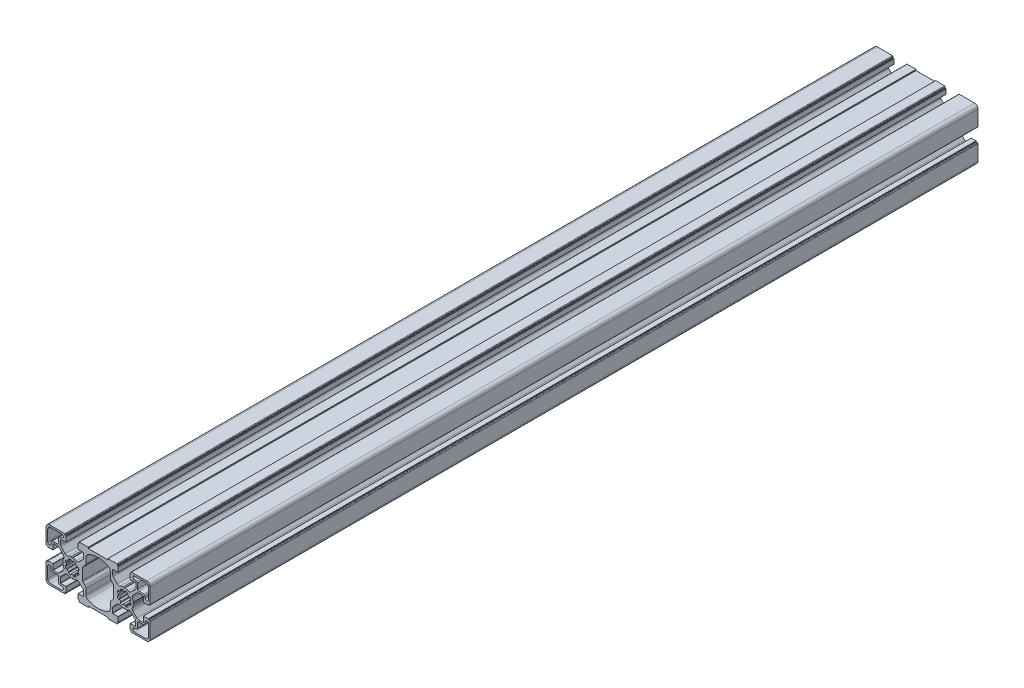
from build123d import *

# Parameters (mm, degrees)
EXTRUDE_1_DEPTH = 715


with BuildPart() as part:
    # Model → Бобышка-Вытянуть1 (new body)
    with BuildSketch(Plane.XY):
        with BuildLine():
            Line((-8.5, 22.500008063), (-8.5, 21.500029888))
            Line((-8.5, 21.500029888), (8.5, 21.500029888))
            Line((8.5, 21.500029888), (8.5, 22.500029888))
            Line((8.5, 22.500029888), (16.124257037, 22.500029888))
            ThreePointArc((16.124257037, 22.500029888), (16.477810482, 22.353583256), (16.624257115, 22.000029811))
            Line((16.624257115, 22.000029811), (16.624257115, 21.300028976))
            ThreePointArc((16.624257115, 21.300028976), (16.712124882, 21.087897421), (16.924256437, 21.000029654))
            Line((16.924256437, 21.000029654), (17.050001302, 21.000029654))
            ThreePointArc((17.050001302, 21.000029654), (17.262133369, 20.912161674), (17.350001348, 20.700029607))
            Line((17.350001348, 20.700029607), (17.350001348, 16.700063723))
            ThreePointArc((17.350001348, 16.700063723), (17.291422695, 16.558642345), (17.150001317, 16.500063692))
            Line((17.150001317, 16.500063692), (12.705479089, 16.500063692))
            ThreePointArc((12.705479089, 16.500063692), (12.56405771, 16.441485039), (12.505479058, 16.300063661))
            Line((12.505479058, 16.300063661), (12.505479058, 12.50480571))
            ThreePointArc((12.505479058, 12.50480571), (12.65349601, 11.760673694), (13.07501266, 11.129828872))
            Line((13.07501266, 11.129828872), (16.654447635, 7.550389883))
            ThreePointArc((16.654447635, 7.550389883), (17.743800748, 6.991162659), (18.954930197, 7.171691748))
            ThreePointArc((18.954930197, 7.171691748), (20.293417106, 7.6897158), (21.702924867, 7.960241203))
            Line((21.702924867, 7.960241203), (22.500002149, 7.50004842))
            Line((22.500002149, 7.50004842), (23.29707943, 7.960241203))
            ThreePointArc((23.29707943, 7.960241203), (24.754381486, 7.675839962), (26.134026772, 7.127030131))
            ThreePointArc((26.134026772, 7.127030131), (27.355110889, 6.933352792), (28.456746709, 7.494562068))
            Line((28.456746709, 7.494562068), (32.019602582, 11.05741794))
            ThreePointArc((32.019602582, 11.05741794), (32.453148282, 11.706264934), (32.605389286, 12.471632147))
            Line((32.605389286, 12.471632147), (32.605389286, 16.300063661))
            ThreePointArc((32.605389286, 16.300063661), (32.546810633, 16.441485039), (32.405389255, 16.500063692))
            Line((32.405389255, 16.500063692), (27.850002979, 16.500063692))
            ThreePointArc((27.850002979, 16.500063692), (27.708581601, 16.558642345), (27.650002948, 16.700063723))
            Line((27.650002948, 16.700063723), (27.650002948, 20.700065567))
            ThreePointArc((27.650002948, 20.700065567), (27.737870569, 20.912196769), (27.950001771, 21.00006439))
            Line((27.950001771, 21.00006439), (28.075713124, 21.00006439))
            ThreePointArc((28.075713124, 21.00006439), (28.287844679, 21.087932157), (28.375712447, 21.300063712))
            Line((28.375712447, 21.300063712), (28.375712447, 22.000064919))
            ThreePointArc((28.375712447, 22.000064919), (28.522158969, 22.3536181), (28.875712151, 22.500064623))
            Line((28.875712151, 22.500064623), (41.999986557, 22.500064623))
            ThreePointArc((41.999986557, 22.500064623), (44.121305645, 21.621385487), (44.999984781, 19.500066399))
            Line((44.999984781, 19.500066399), (44.999984781, 6.375792367))
            ThreePointArc((44.999984781, 6.375792367), (44.853538149, 6.022238922), (44.499984704, 5.87579229))
            Line((44.499984704, 5.87579229), (43.799983869, 5.87579229))
            ThreePointArc((43.799983869, 5.87579229), (43.587852314, 5.787924523), (43.499984547, 5.575792967))
            Line((43.499984547, 5.575792967), (43.499984547, 5.450048103))
            ThreePointArc((43.499984547, 5.450048103), (43.412116567, 5.237916036), (43.1999845, 5.150048056))
            Line((43.1999845, 5.150048056), (39.200018616, 5.150048056))
            ThreePointArc((39.200018616, 5.150048056), (39.058597238, 5.208626709), (39.000018585, 5.350048087))
            Line((39.000018585, 5.350048087), (39.000018585, 9.794570316))
            ThreePointArc((39.000018585, 9.794570316), (38.941439932, 9.935991694), (38.800018554, 9.994570347))
            Line((38.800018554, 9.994570347), (35.004760603, 9.994570347))
            ThreePointArc((35.004760603, 9.994570347), (34.260628587, 9.846553394), (33.629783765, 9.425036744))
            Line((33.629783765, 9.425036744), (30.050344776, 5.84560177))
            ThreePointArc((30.050344776, 5.84560177), (29.491117552, 4.756248656), (29.671646641, 3.545119207))
            ThreePointArc((29.671646641, 3.545119207), (30.189670693, 2.206632298), (30.460196096, 0.797124537))
            Line((30.460196096, 0.797124537), (30.000003313, 4.7256e-05))
            Line((30.000003313, 4.7256e-05), (30.460196096, -0.797030026))
            ThreePointArc((30.460196096, -0.797030026), (30.175794855, -2.254332081), (29.626985024, -3.633977367))
            ThreePointArc((29.626985024, -3.633977367), (29.433307685, -4.855061485), (29.994516961, -5.956697305))
            Line((29.994516961, -5.956697305), (33.557372833, -9.519553177))
            ThreePointArc((33.557372833, -9.519553177), (34.206219827, -9.953098877), (34.97158704, -10.105339882))
            Line((34.97158704, -10.105339882), (38.800018554, -10.105339882))
            ThreePointArc((38.800018554, -10.105339882), (38.941439932, -10.046761229), (39.000018585, -9.905339851))
            Line((39.000018585, -9.905339851), (39.000018585, -5.349953575))
            ThreePointArc((39.000018585, -5.349953575), (39.058597238, -5.208532197), (39.200018616, -5.149953544))
            Line((39.200018616, -5.149953544), (43.20002046, -5.149953544))
            ThreePointArc((43.20002046, -5.149953544), (43.412151662, -5.237821164), (43.500019283, -5.449952366))
            Line((43.500019283, -5.449952366), (43.500019283, -5.57566372))
            ThreePointArc((43.500019283, -5.57566372), (43.58788705, -5.787795275), (43.800018605, -5.875663042))
            Line((43.800018605, -5.875663042), (44.500035031, -5.875663042))
            ThreePointArc((44.500035031, -5.875663042), (44.853595863, -6.022117215), (45.000034735, -6.375684384))
            Line((45.000034735, -6.375684384), (45.000034735, -19.499937152))
            ThreePointArc((45.000034735, -19.499937152), (44.121350218, -21.621261621), (42.000021292, -22.499935377))
            Line((42.000021292, -22.499935377), (28.87574726, -22.499935377))
            ThreePointArc((28.87574726, -22.499935377), (28.522193815, -22.353488745), (28.375747183, -21.999935299))
            Line((28.375747183, -21.999935299), (28.375747183, -21.299934465))
            ThreePointArc((28.375747183, -21.299934465), (28.287879416, -21.087802909), (28.07574786, -20.999935142))
            Line((28.07574786, -20.999935142), (27.950002996, -20.999935142))
            ThreePointArc((27.950002996, -20.999935142), (27.737870929, -20.912067163), (27.650002949, -20.699935096))
            Line((27.650002949, -20.699935096), (27.650002949, -16.699969212))
            ThreePointArc((27.650002949, -16.699969212), (27.708581602, -16.558547833), (27.85000298, -16.49996918))
            Line((27.85000298, -16.49996918), (32.294525209, -16.49996918))
            ThreePointArc((32.294525209, -16.49996918), (32.435946587, -16.441390528), (32.49452524, -16.299969149))
            Line((32.49452524, -16.299969149), (32.49452524, -12.504711198))
            ThreePointArc((32.49452524, -12.504711198), (32.346508287, -11.760579183), (31.924991638, -11.129734361))
            Line((31.924991638, -11.129734361), (28.345556663, -7.550295371))
            ThreePointArc((28.345556663, -7.550295371), (27.256203549, -6.991068147), (26.0450741, -7.171597237))
            ThreePointArc((26.0450741, -7.171597237), (24.706587191, -7.689621288), (23.29707943, -7.960146691))
            Line((23.29707943, -7.960146691), (22.500002149, -7.499953908))
            Line((22.500002149, -7.499953908), (21.702924867, -7.960146691))
            ThreePointArc((21.702924867, -7.960146691), (20.245622812, -7.675745451), (18.865977526, -7.12693562))
            ThreePointArc((18.865977526, -7.12693562), (17.644893409, -6.93325828), (16.543257588, -7.494467557))
            Line((16.543257588, -7.494467557), (12.980401716, -11.057323429))
            ThreePointArc((12.980401716, -11.057323429), (12.546856016, -11.706170422), (12.394615011, -12.471537636))
            Line((12.394615011, -12.471537636), (12.394615011, -16.299969149))
            ThreePointArc((12.394615011, -16.299969149), (12.453193664, -16.441390528), (12.594615042, -16.49996918))
            Line((12.594615042, -16.49996918), (17.150001318, -16.49996918))
            ThreePointArc((17.150001318, -16.49996918), (17.291422696, -16.558547833), (17.350001349, -16.699969212))
            Line((17.350001349, -16.699969212), (17.350001349, -20.699971056))
            ThreePointArc((17.350001349, -20.699971056), (17.262133729, -20.912102258), (17.050002527, -20.999969878))
            Line((17.050002527, -20.999969878), (16.924291173, -20.999969878))
            ThreePointArc((16.924291173, -20.999969878), (16.712159618, -21.087837646), (16.624291851, -21.299969201))
            Line((16.624291851, -21.299969201), (16.624291851, -21.999970408))
            ThreePointArc((16.624291851, -21.999970408), (16.477845328, -22.353523589), (16.124292147, -22.499970112))
            Line((16.124292147, -22.499970112), (8.5, -22.499970112))
            Line((8.5, -22.499970112), (8.5, -21.499970112))
            Line((8.5, -21.499970112), (-5.500036511, -21.499970112))
            Line((-5.500036511, -21.499970112), (-8.5, -21.499970112))
            Line((-8.5, -21.499970112), (-8.5, -22.499991936))
            Line((-8.5, -22.499991936), (-16.124237521, -22.499991936))
            ThreePointArc((-16.124237521, -22.499991936), (-16.477790966, -22.353545304), (-16.624237598, -21.999991859))
            Line((-16.624237598, -21.999991859), (-16.624237598, -21.299991024))
            ThreePointArc((-16.624237598, -21.299991024), (-16.712105366, -21.087859469), (-16.924236921, -20.999991702))
            Line((-16.924236921, -20.999991702), (-17.049981785, -20.999991702))
            ThreePointArc((-17.049981785, -20.999991702), (-17.262113853, -20.912123722), (-17.349981832, -20.699991655))
            Line((-17.349981832, -20.699991655), (-17.349981832, -16.700025771))
            ThreePointArc((-17.349981832, -16.700025771), (-17.291403179, -16.558604393), (-17.149981801, -16.50002574))
            Line((-17.149981801, -16.50002574), (-12.705459572, -16.50002574))
            ThreePointArc((-12.705459572, -16.50002574), (-12.564038194, -16.441447087), (-12.505459541, -16.300025709))
            Line((-12.505459541, -16.300025709), (-12.505459541, -12.504767758))
            ThreePointArc((-12.505459541, -12.504767758), (-12.653476494, -11.760635742), (-13.074993144, -11.129790921))
            Line((-13.074993144, -11.129790921), (-16.654428119, -7.550351931))
            ThreePointArc((-16.654428119, -7.550351931), (-17.743781232, -6.991124707), (-18.954910681, -7.171653796))
            ThreePointArc((-18.954910681, -7.171653796), (-20.29339759, -7.689677848), (-21.702905351, -7.960203251))
            Line((-21.702905351, -7.960203251), (-22.499982633, -7.500010468))
            Line((-22.499982633, -7.500010468), (-23.297059914, -7.960203251))
            ThreePointArc((-23.297059914, -7.960203251), (-24.754361969, -7.67580201), (-26.134007256, -7.126992179))
            ThreePointArc((-26.134007256, -7.126992179), (-27.355091373, -6.93331484), (-28.456727193, -7.494524116))
            Line((-28.456727193, -7.494524116), (-32.019583065, -11.057379988))
            ThreePointArc((-32.019583065, -11.057379988), (-32.453128766, -11.706226982), (-32.60536977, -12.471594195))
            Line((-32.60536977, -12.471594195), (-32.60536977, -16.300025709))
            ThreePointArc((-32.60536977, -16.300025709), (-32.546791117, -16.441447087), (-32.405369739, -16.50002574))
            Line((-32.405369739, -16.50002574), (-27.849983463, -16.50002574))
            ThreePointArc((-27.849983463, -16.50002574), (-27.708562085, -16.558604393), (-27.649983432, -16.700025771))
            Line((-27.649983432, -16.700025771), (-27.649983432, -20.700027615))
            ThreePointArc((-27.649983432, -20.700027615), (-27.737851053, -20.912158817), (-27.949982254, -21.000026438))
            Line((-27.949982254, -21.000026438), (-28.075693608, -21.000026438))
            ThreePointArc((-28.075693608, -21.000026438), (-28.287825163, -21.087894205), (-28.37569293, -21.30002576))
            Line((-28.37569293, -21.30002576), (-28.37569293, -22.000026967))
            ThreePointArc((-28.37569293, -22.000026967), (-28.522139453, -22.353580148), (-28.875692635, -22.500026671))
            Line((-28.875692635, -22.500026671), (-41.999967041, -22.500026671))
            ThreePointArc((-41.999967041, -22.500026671), (-44.121286129, -21.621347535), (-44.999965265, -19.500028447))
            Line((-44.999965265, -19.500028447), (-44.999965265, -6.375754415))
            ThreePointArc((-44.999965265, -6.375754415), (-44.853518633, -6.02220097), (-44.499965187, -5.875754338))
            Line((-44.499965187, -5.875754338), (-43.799964353, -5.875754338))
            ThreePointArc((-43.799964353, -5.875754338), (-43.587832798, -5.787886571), (-43.49996503, -5.575755015))
            Line((-43.49996503, -5.575755015), (-43.49996503, -5.450010151))
            ThreePointArc((-43.49996503, -5.450010151), (-43.412097051, -5.237878083), (-43.199964984, -5.150010104))
            Line((-43.199964984, -5.150010104), (-39.1999991, -5.150010104))
            ThreePointArc((-39.1999991, -5.150010104), (-39.058577722, -5.208588757), (-38.999999069, -5.350010135))
            Line((-38.999999069, -5.350010135), (-38.999999069, -9.794532364))
            ThreePointArc((-38.999999069, -9.794532364), (-38.941420416, -9.935953742), (-38.799999038, -9.994532395))
            Line((-38.799999038, -9.994532395), (-35.004741087, -9.994532395))
            ThreePointArc((-35.004741087, -9.994532395), (-34.260609071, -9.846515442), (-33.629764249, -9.424998792))
            Line((-33.629764249, -9.424998792), (-30.050325259, -5.845563818))
            ThreePointArc((-30.050325259, -5.845563818), (-29.491098036, -4.756210704), (-29.671627125, -3.545081255))
            ThreePointArc((-29.671627125, -3.545081255), (-30.189651176, -2.206594346), (-30.460176579, -0.797086585))
            Line((-30.460176579, -0.797086585), (-29.999983796, -9.304e-06))
            Line((-29.999983796, -9.304e-06), (-30.460176579, 0.797067977))
            ThreePointArc((-30.460176579, 0.797067977), (-30.175775339, 2.254370033), (-29.626965508, 3.634015319))
            ThreePointArc((-29.626965508, 3.634015319), (-29.433288168, 4.855099436), (-29.994497445, 5.956735257))
            Line((-29.994497445, 5.956735257), (-33.557353317, 9.519591129))
            ThreePointArc((-33.557353317, 9.519591129), (-34.20620031, 9.953136829), (-34.971567524, 10.105377833))
            Line((-34.971567524, 10.105377833), (-38.799999037, 10.105377833))
            ThreePointArc((-38.799999037, 10.105377833), (-38.941420416, 10.046799181), (-38.999999068, 9.905377802))
            Line((-38.999999068, 9.905377802), (-38.999999068, 5.349991526))
            ThreePointArc((-38.999999068, 5.349991526), (-39.058577721, 5.208570148), (-39.199999099, 5.149991495))
            Line((-39.199999099, 5.149991495), (-43.200000944, 5.149991495))
            ThreePointArc((-43.200000944, 5.149991495), (-43.412132146, 5.237859116), (-43.499999766, 5.449990318))
            Line((-43.499999766, 5.449990318), (-43.499999766, 5.575701671))
            ThreePointArc((-43.499999766, 5.575701671), (-43.587867533, 5.787833227), (-43.799999089, 5.875700994))
            Line((-43.799999089, 5.875700994), (-44.500000296, 5.875700994))
            ThreePointArc((-44.500000296, 5.875700994), (-44.853553477, 6.022147517), (-45, 6.375700698))
            Line((-45, 6.375700698), (-45, 19.499975104))
            ThreePointArc((-45, 19.499975104), (-44.121320863, 21.621294192), (-42.000001775, 22.499973328))
            Line((-42.000001775, 22.499973328), (-28.875727744, 22.499973328))
            ThreePointArc((-28.875727744, 22.499973328), (-28.522174298, 22.353526696), (-28.375727666, 21.999973251))
            Line((-28.375727666, 21.999973251), (-28.375727666, 21.299972416))
            ThreePointArc((-28.375727666, 21.299972416), (-28.287859899, 21.087840861), (-28.075728344, 20.999973094))
            Line((-28.075728344, 20.999973094), (-27.949983479, 20.999973094))
            ThreePointArc((-27.949983479, 20.999973094), (-27.737851412, 20.912105114), (-27.649983433, 20.699973047))
            Line((-27.649983433, 20.699973047), (-27.649983433, 16.700007163))
            ThreePointArc((-27.649983433, 16.700007163), (-27.708562086, 16.558585785), (-27.849983464, 16.500007132))
            Line((-27.849983464, 16.500007132), (-32.294505692, 16.500007132))
            ThreePointArc((-32.294505692, 16.500007132), (-32.435927071, 16.441428479), (-32.494505723, 16.300007101))
            Line((-32.494505723, 16.300007101), (-32.494505723, 12.50474915))
            ThreePointArc((-32.494505723, 12.50474915), (-32.346488771, 11.760617134), (-31.924972121, 11.129772312))
            Line((-31.924972121, 11.129772312), (-28.345537146, 7.550333323))
            ThreePointArc((-28.345537146, 7.550333323), (-27.256184033, 6.991106099), (-26.045054584, 7.171635188))
            ThreePointArc((-26.045054584, 7.171635188), (-24.706567675, 7.68965924), (-23.297059914, 7.960184643))
            Line((-23.297059914, 7.960184643), (-22.499982632, 7.49999186))
            Line((-22.499982632, 7.49999186), (-21.702905351, 7.960184643))
            ThreePointArc((-21.702905351, 7.960184643), (-20.245603296, 7.675783402), (-18.865958009, 7.126973571))
            ThreePointArc((-18.865958009, 7.126973571), (-17.644873892, 6.933296232), (-16.543238072, 7.494505508))
            Line((-16.543238072, 7.494505508), (-12.9803822, 11.05736138))
            ThreePointArc((-12.9803822, 11.05736138), (-12.546836499, 11.706208374), (-12.394595495, 12.471575587))
            Line((-12.394595495, 12.471575587), (-12.394595495, 16.300007101))
            ThreePointArc((-12.394595495, 16.300007101), (-12.453174148, 16.441428479), (-12.594595526, 16.500007132))
            Line((-12.594595526, 16.500007132), (-17.149981802, 16.500007132))
            ThreePointArc((-17.149981802, 16.500007132), (-17.29140318, 16.558585785), (-17.349981833, 16.700007163))
            Line((-17.349981833, 16.700007163), (-17.349981833, 20.700009007))
            ThreePointArc((-17.349981833, 20.700009007), (-17.262114212, 20.912140209), (-17.049983011, 21.00000783))
            Line((-17.049983011, 21.00000783), (-16.924271657, 21.00000783))
            ThreePointArc((-16.924271657, 21.00000783), (-16.712140102, 21.087875597), (-16.624272334, 21.300007152))
            Line((-16.624272334, 21.300007152), (-16.624272334, 22.000008359))
            ThreePointArc((-16.624272334, 22.000008359), (-16.477825812, 22.35356154), (-16.12427263, 22.500008063))
            Line((-16.12427263, 22.500008063), (-8.5, 22.500008063))
        make_face()
        with BuildLine():
            Line((-43.499999767, 8.999971231), (-43.499999767, 18.499974573))
            ThreePointArc((-43.499999767, 18.499974573), (-42.767767153, 20.26774048), (-41.000001246, 20.999973094))
            Line((-41.000001246, 20.999973094), (-31.500188904, 20.999973094))
            Line((-31.500188904, 20.999973094), (-31.490188671, 20.999973094))
            ThreePointArc((-31.490188671, 20.999973094), (-30.436599567, 20.563562198), (-30.000188671, 19.509973094))
            Line((-30.000188671, 19.509973094), (-30.000188671, 19.489972628))
            ThreePointArc((-30.000188671, 19.489972628), (-30.436599567, 18.436383524), (-31.490188671, 17.999972628))
            Line((-31.490188671, 17.999972628), (-31.500188671, 17.999972628))
            Line((-31.500188671, 17.999972628), (-32.994505801, 17.999972628))
            ThreePointArc((-32.994505801, 17.999972628), (-33.701612692, 17.707079364), (-33.994505957, 16.999972473))
            Line((-33.994505957, 16.999972473), (-33.994505957, 12.605378221))
            ThreePointArc((-33.994505957, 12.605378221), (-34.287399221, 11.89827133), (-34.994506112, 11.605378066))
            Line((-34.994506112, 11.605378066), (-39.499999146, 11.605378066))
            ThreePointArc((-39.499999146, 11.605378066), (-40.207106037, 11.312484802), (-40.499999301, 10.605377911))
            Line((-40.499999301, 10.605377911), (-40.499999301, 8.999970998))
            ThreePointArc((-40.499999301, 8.999970998), (-40.939339211, 7.939310744), (-41.999999534, 7.499970998))
            ThreePointArc((-41.999999534, 7.499970998), (-43.06065987, 7.939310895), (-43.499999767, 8.999971231))
        make_face(mode=Mode.SUBTRACT)
        with BuildLine():
            Line((-19.308670231, 4.56258962), (-19.635981767, 4.098466852))
            ThreePointArc((-19.635981767, 4.098466852), (-18.969849134, 3.540917869), (-18.410269108, 2.876490487))
            Line((-18.410269108, 2.876490487), (-17.933204273, 3.208153697))
            ThreePointArc((-17.933204273, 3.208153697), (-17.531021017, 3.29876189), (-17.197483921, 3.056451713))
            ThreePointArc((-17.197483921, 3.056451713), (-16.849314042, 2.354717818), (-16.593945552, 1.6141507))
            ThreePointArc((-16.593945552, 1.6141507), (-16.659386206, 1.205563782), (-17.010251083, 0.986202009))
            Line((-17.010251083, 0.986202009), (-17.579436103, 0.887813659))
            ThreePointArc((-17.579436103, 0.887813659), (-17.499981856, -9.304e-06), (-17.579436103, -0.887832267))
            Line((-17.579436103, -0.887832267), (-17.010251083, -0.986220617))
            ThreePointArc((-17.010251083, -0.986220617), (-16.659386206, -1.20558239), (-16.593945552, -1.614169308))
            ThreePointArc((-16.593945552, -1.614169308), (-16.849314042, -2.354736426), (-17.197483921, -3.056470321))
            ThreePointArc((-17.197483921, -3.056470321), (-17.531021017, -3.298780498), (-17.933204273, -3.208172305))
            Line((-17.933204273, -3.208172305), (-18.410269108, -2.876509095))
            ThreePointArc((-18.410269108, -2.876509095), (-18.969849134, -3.540936477), (-19.635981767, -4.09848546))
            Line((-19.635981767, -4.09848546), (-19.308670231, -4.562608228))
            ThreePointArc((-19.308670231, -4.562608228), (-19.215682631, -4.965821479), (-19.45832639, -5.30101042))
            ThreePointArc((-19.45832639, -5.30101042), (-20.162539348, -5.644083818), (-20.904910968, -5.894083067))
            ThreePointArc((-20.904910968, -5.894083067), (-21.312126729, -5.829599372), (-21.532460802, -5.48112309))
            Line((-21.532460802, -5.48112309), (-21.632593761, -4.924199015))
            ThreePointArc((-21.632593761, -4.924199015), (-22.499982632, -5.00001008), (-23.367371504, -4.924199015))
            Line((-23.367371504, -4.924199015), (-23.467504463, -5.48112309))
            ThreePointArc((-23.467504463, -5.48112309), (-23.687838536, -5.829599372), (-24.095054297, -5.894083067))
            ThreePointArc((-24.095054297, -5.894083067), (-24.838878968, -5.643487876), (-25.544368075, -5.299455592))
            ThreePointArc((-25.544368075, -5.299455592), (-25.784598509, -4.964285149), (-25.691295034, -4.562608228))
            Line((-25.691295034, -4.562608228), (-25.363983498, -4.09848546))
            ThreePointArc((-25.363983498, -4.09848546), (-26.030116131, -3.540936477), (-26.589696157, -2.876509095))
            Line((-26.589696157, -2.876509095), (-27.066760992, -3.208172305))
            ThreePointArc((-27.066760992, -3.208172305), (-27.468944248, -3.298780498), (-27.802481344, -3.056470321))
            ThreePointArc((-27.802481344, -3.056470321), (-28.151243494, -2.35332055), (-28.406831214, -1.611208998))
            ThreePointArc((-28.406831214, -1.611208998), (-28.339735602, -1.204302514), (-27.989714182, -0.986220617))
            Line((-27.989714182, -0.986220617), (-27.420529162, -0.887832267))
            ThreePointArc((-27.420529162, -0.887832267), (-27.499983409, -9.304e-06), (-27.420529162, 0.887813659))
            Line((-27.420529162, 0.887813659), (-27.989714182, 0.986202009))
            ThreePointArc((-27.989714182, 0.986202009), (-28.339735602, 1.204283906), (-28.406831214, 1.61119039))
            ThreePointArc((-28.406831214, 1.61119039), (-28.151243494, 2.353301942), (-27.802481344, 3.056451713))
            ThreePointArc((-27.802481344, 3.056451713), (-27.468944248, 3.29876189), (-27.066760992, 3.208153697))
            Line((-27.066760992, 3.208153697), (-26.589696157, 2.876490487))
            ThreePointArc((-26.589696157, 2.876490487), (-26.030116131, 3.540917869), (-25.363983498, 4.098466852))
            Line((-25.363983498, 4.098466852), (-25.691295034, 4.56258962))
            ThreePointArc((-25.691295034, 4.56258962), (-25.784598509, 4.964266541), (-25.544368075, 5.299436984))
            ThreePointArc((-25.544368075, 5.299436984), (-24.838878968, 5.643469268), (-24.095054297, 5.894064459))
            ThreePointArc((-24.095054297, 5.894064459), (-23.687838536, 5.829580764), (-23.467504463, 5.481104482))
            Line((-23.467504463, 5.481104482), (-23.367371504, 4.924180407))
            ThreePointArc((-23.367371504, 4.924180407), (-22.499982632, 4.999991472), (-21.632593761, 4.924180407))
            Line((-21.632593761, 4.924180407), (-21.532460802, 5.481104482))
            ThreePointArc((-21.532460802, 5.481104482), (-21.312126729, 5.829580764), (-20.904910968, 5.894064459))
            ThreePointArc((-20.904910968, 5.894064459), (-20.162539348, 5.64406521), (-19.45832639, 5.300991812))
            ThreePointArc((-19.45832639, 5.300991812), (-19.215682631, 4.965802871), (-19.308670231, 4.56258962))
        make_face(mode=Mode.SUBTRACT)
        with BuildLine():
            Line((10.5, 14.21), (10.5, 9.452657001))
            ThreePointArc((10.5, 9.452657001), (10.728361402, 8.304606704), (11.378679656, 7.331336658))
            Line((11.378679656, 7.331336658), (13.035533906, 5.674482408))
            ThreePointArc((13.035533906, 5.674482408), (13.252306657, 5.350059059), (13.328427125, 4.967375627))
            Line((13.328427125, 4.967375627), (13.328427125, -4.967342999))
            ThreePointArc((13.328427125, -4.967342999), (13.252306657, -5.350026431), (13.035533906, -5.67444978))
            Line((13.035533906, -5.67444978), (11.378679656, -7.331304029))
            ThreePointArc((11.378679656, -7.331304029), (10.728361402, -8.304574076), (10.5, -9.452624373))
            Line((10.5, -9.452624373), (10.5, -14.21))
            ThreePointArc((10.5, -14.21), (10.06913889, -15.759040143), (8.900316423, -16.863132849))
            ThreePointArc((8.900316423, -16.863132849), (0, -19.067796987), (-8.900316423, -16.863132849))
            ThreePointArc((-8.900316423, -16.863132849), (-10.06913889, -15.759040143), (-10.5, -14.21))
            Line((-10.5, -14.21), (-10.5, -9.452640687))
            ThreePointArc((-10.5, -9.452640687), (-10.728361402, -8.30459039), (-11.378679656, -7.331320344))
            Line((-11.378679656, -7.331320344), (-13.035533906, -5.674466094))
            ThreePointArc((-13.035533906, -5.674466094), (-13.252306657, -5.350042745), (-13.328427125, -4.967359313))
            Line((-13.328427125, -4.967359313), (-13.328427125, 4.967359313))
            ThreePointArc((-13.328427125, 4.967359313), (-13.252306657, 5.350042745), (-13.035533906, 5.674466094))
            Line((-13.035533906, 5.674466094), (-11.378679656, 7.331320344))
            ThreePointArc((-11.378679656, 7.331320344), (-10.728361402, 8.30459039), (-10.5, 9.452640687))
            Line((-10.5, 9.452640687), (-10.5, 14.21))
            ThreePointArc((-10.5, 14.21), (-10.06913889, 15.759040143), (-8.900316423, 16.863132849))
            ThreePointArc((-8.900316423, 16.863132849), (0, 19.067796987), (8.900316423, 16.863132849))
            ThreePointArc((8.900316423, 16.863132849), (10.06913889, 15.759040143), (10.5, 14.21))
        make_face(mode=Mode.SUBTRACT)
        with BuildLine():
            Line((29.99999767, 19.510042752), (29.99999767, 19.490042287))
            ThreePointArc((29.99999767, 19.490042287), (30.436408566, 18.436453183), (31.48999767, 18.000042287))
            Line((31.48999767, 18.000042287), (31.49999767, 18.000042287))
            Line((31.49999767, 18.000042287), (33.105404583, 18.000042287))
            ThreePointArc((33.105404583, 18.000042287), (33.812511474, 17.707149022), (34.105404738, 17.000042131))
            Line((34.105404738, 17.000042131), (34.105404738, 12.494549098))
            ThreePointArc((34.105404738, 12.494549098), (34.398298002, 11.787442207), (35.105404893, 11.494548942))
            Line((35.105404893, 11.494548942), (39.499999144, 11.494548942))
            ThreePointArc((39.499999144, 11.494548942), (40.207106035, 11.201655678), (40.4999993, 10.494548787))
            Line((40.4999993, 10.494548787), (40.4999993, 9.000231657))
            ThreePointArc((40.4999993, 9.000231657), (40.939339128, 7.939571485), (41.9999993, 7.500231657))
            ThreePointArc((41.9999993, 7.500231657), (43.060659787, 7.939571471), (43.499999765, 9.00023189))
            Line((43.499999765, 9.00023189), (43.499999765, 18.500044232))
            ThreePointArc((43.499999765, 18.500044232), (42.767767152, 20.267810139), (41.000001245, 21.000042752))
            Line((41.000001245, 21.000042752), (31.49999767, 21.000042752))
            Line((31.49999767, 21.000042752), (31.48999767, 21.000042752))
            ThreePointArc((31.48999767, 21.000042752), (30.436408566, 20.563631856), (29.99999767, 19.510042752))
        make_face(mode=Mode.SUBTRACT)
        with BuildLine():
            Line((-31.499962935, -21.000026438), (-40.99996651, -21.000026438))
            ThreePointArc((-40.99996651, -21.000026438), (-42.767732417, -20.267793825), (-43.49996503, -18.500027918))
            Line((-43.49996503, -18.500027918), (-43.49996503, -9.000215576))
            ThreePointArc((-43.49996503, -9.000215576), (-43.060625134, -7.939555239), (-41.999964798, -7.500215343))
            ThreePointArc((-41.999964798, -7.500215343), (-40.939304475, -7.939555089), (-40.499964565, -9.000215343))
            Line((-40.499964565, -9.000215343), (-40.499964565, -10.494532473))
            ThreePointArc((-40.499964565, -10.494532473), (-40.2070713, -11.201639364), (-39.499964409, -11.494532628))
            Line((-39.499964409, -11.494532628), (-35.105370158, -11.494532628))
            ThreePointArc((-35.105370158, -11.494532628), (-34.398263267, -11.787425892), (-34.105370003, -12.494532783))
            Line((-34.105370003, -12.494532783), (-34.105370003, -17.000025817))
            ThreePointArc((-34.105370003, -17.000025817), (-33.812476738, -17.707132708), (-33.105369848, -18.000025973))
            Line((-33.105369848, -18.000025973), (-31.499962935, -18.000025973))
            ThreePointArc((-31.499962935, -18.000025973), (-30.439302598, -18.439365965), (-29.999962935, -19.500026438))
            ThreePointArc((-29.999962935, -19.500026438), (-30.439302763, -20.56068661), (-31.499962935, -21.000026438))
        make_face(mode=Mode.SUBTRACT)
        with BuildLine():
            Line((30.000223406, -19.449956314), (30.000223406, -19.54995678))
            ThreePointArc((30.000223406, -19.54995678), (30.424918573, -20.575261612), (31.450223406, -20.99995678))
            Line((31.450223406, -20.99995678), (41.000035981, -20.99995678))
            ThreePointArc((41.000035981, -20.99995678), (42.767801888, -20.267724166), (43.500034502, -18.499958259))
            Line((43.500034502, -18.499958259), (43.500034502, -8.999954917))
            ThreePointArc((43.500034502, -8.999954917), (43.060694523, -7.939294498), (42.000034036, -7.499954684))
            ThreePointArc((42.000034036, -7.499954684), (40.939373864, -7.939294512), (40.500034036, -8.999954684))
            Line((40.500034036, -8.999954684), (40.500034036, -10.605361597))
            ThreePointArc((40.500034036, -10.605361597), (40.207140772, -11.312468488), (39.500033881, -11.605361752))
            Line((39.500033881, -11.605361752), (34.994540847, -11.605361752))
            ThreePointArc((34.994540847, -11.605361752), (34.287433956, -11.898255016), (33.994540692, -12.605361907))
            Line((33.994540692, -12.605361907), (33.994540692, -16.999956159))
            ThreePointArc((33.994540692, -16.999956159), (33.701647427, -17.70706305), (32.994540536, -17.999956314))
            Line((32.994540536, -17.999956314), (31.450223406, -17.999956314))
            ThreePointArc((31.450223406, -17.999956314), (30.424918573, -18.424651481), (30.000223406, -19.449956314))
        make_face(mode=Mode.SUBTRACT)
        with BuildLine():
            Line((21.532492622, 5.481150338), (21.63262558, 4.924226263))
            ThreePointArc((21.63262558, 4.924226263), (22.500007279, 5.000035356), (23.367388822, 4.924224483))
            Line((23.367388822, 4.924224483), (23.46752178, 5.481148558))
            ThreePointArc((23.46752178, 5.481148558), (23.687859663, 5.829623491), (24.095077052, 5.894102632))
            ThreePointArc((24.095077052, 5.894102632), (24.838901723, 5.643507441), (25.54439083, 5.299475158))
            ThreePointArc((25.54439083, 5.299475158), (25.784609206, 4.964311923), (25.691314551, 4.56264618))
            Line((25.691314551, 4.56264618), (25.364003014, 4.098523412))
            ThreePointArc((25.364003014, 4.098523412), (26.030135647, 3.540974429), (26.589715674, 2.876547046))
            Line((26.589715674, 2.876547046), (27.066780509, 3.208210257))
            ThreePointArc((27.066780509, 3.208210257), (27.468970021, 3.298812301), (27.802504099, 3.056489886))
            ThreePointArc((27.802504099, 3.056489886), (28.151266249, 2.353340115), (28.406853969, 1.611228564))
            ThreePointArc((28.406853969, 1.611228564), (28.339748726, 1.204333109), (27.989733698, 0.986258569))
            Line((27.989733698, 0.986258569), (27.420548678, 0.887870219))
            ThreePointArc((27.420548678, 0.887870219), (27.500002925, 4.7256e-05), (27.420548678, -0.887775708))
            Line((27.420548678, -0.887775708), (27.989733698, -0.986164057))
            ThreePointArc((27.989733698, -0.986164057), (28.339765776, -1.204251159), (28.406853969, -1.611170825))
            ThreePointArc((28.406853969, -1.611170825), (28.151266249, -2.353282376), (27.802504099, -3.056432147))
            ThreePointArc((27.802504099, -3.056432147), (27.468961187, -3.298733682), (27.066780509, -3.208115745))
            Line((27.066780509, -3.208115745), (26.589715674, -2.876452535))
            ThreePointArc((26.589715674, -2.876452535), (26.030135647, -3.540879917), (25.364003014, -4.098428901))
            Line((25.364003014, -4.098428901), (25.691314551, -4.562551668))
            ThreePointArc((25.691314551, -4.562551668), (25.784629658, -4.964238216), (25.54439083, -5.299417419))
            ThreePointArc((25.54439083, -5.299417419), (24.838901723, -5.643449702), (24.095077052, -5.894044893))
            ThreePointArc((24.095077052, -5.894044893), (23.687861291, -5.829561199), (23.467527218, -5.481084917))
            Line((23.467527218, -5.481084917), (23.367394259, -4.924160841))
            ThreePointArc((23.367394259, -4.924160841), (22.50001152, -4.99997219), (21.632628496, -4.924164092))
            Line((21.632628496, -4.924164092), (21.532495537, -5.481088168))
            ThreePointArc((21.532495537, -5.481088168), (21.312161464, -5.82956445), (20.904945703, -5.894048145))
            ThreePointArc((20.904945703, -5.894048145), (20.162574083, -5.644048896), (19.458361125, -5.300975497))
            ThreePointArc((19.458361125, -5.300975497), (19.215715506, -4.965782071), (19.308709447, -4.562565435))
            Line((19.308709447, -4.562565435), (19.636020983, -4.098442667))
            ThreePointArc((19.636020983, -4.098442667), (18.969886528, -3.54089774), (18.410303843, -2.876474172))
            Line((18.410303843, -2.876474172), (17.933239008, -3.208137383))
            ThreePointArc((17.933239008, -3.208137383), (17.531055752, -3.298745576), (17.197518656, -3.056435399))
            ThreePointArc((17.197518656, -3.056435399), (16.849348778, -2.354701504), (16.593980287, -1.614134386))
            ThreePointArc((16.593980287, -1.614134386), (16.659422715, -1.205543183), (17.01029416, -0.986183406))
            Line((17.01029416, -0.986183406), (17.57947918, -0.887795056))
            ThreePointArc((17.57947918, -0.887795056), (17.500021123, 3.5643e-05), (17.579475056, 0.887866712))
            Line((17.579475056, 0.887866712), (17.010290036, 0.986255062))
            ThreePointArc((17.010290036, 0.986255062), (16.660268615, 1.204336958), (16.593173003, 1.611243443))
            ThreePointArc((16.593173003, 1.611243443), (16.848759429, 2.353345723), (17.197518032, 3.056486996))
            ThreePointArc((17.197518032, 3.056486996), (17.531055128, 3.298797173), (17.933238384, 3.20818898))
            Line((17.933238384, 3.20818898), (18.410303219, 2.87652577))
            ThreePointArc((18.410303219, 2.87652577), (18.969882532, 3.540954127), (19.636015132, 4.098503593))
            Line((19.636015132, 4.098503593), (19.308703596, 4.562626361))
            ThreePointArc((19.308703596, 4.562626361), (19.215709655, 4.965842998), (19.458355273, 5.301036424))
            ThreePointArc((19.458355273, 5.301036424), (20.162569656, 5.644110547), (20.904942788, 5.894110315))
            ThreePointArc((20.904942788, 5.894110315), (21.312158549, 5.829626621), (21.532492622, 5.481150338))
        make_face(mode=Mode.SUBTRACT)
    extrude(amount=-EXTRUDE_1_DEPTH)


solid = part.part
